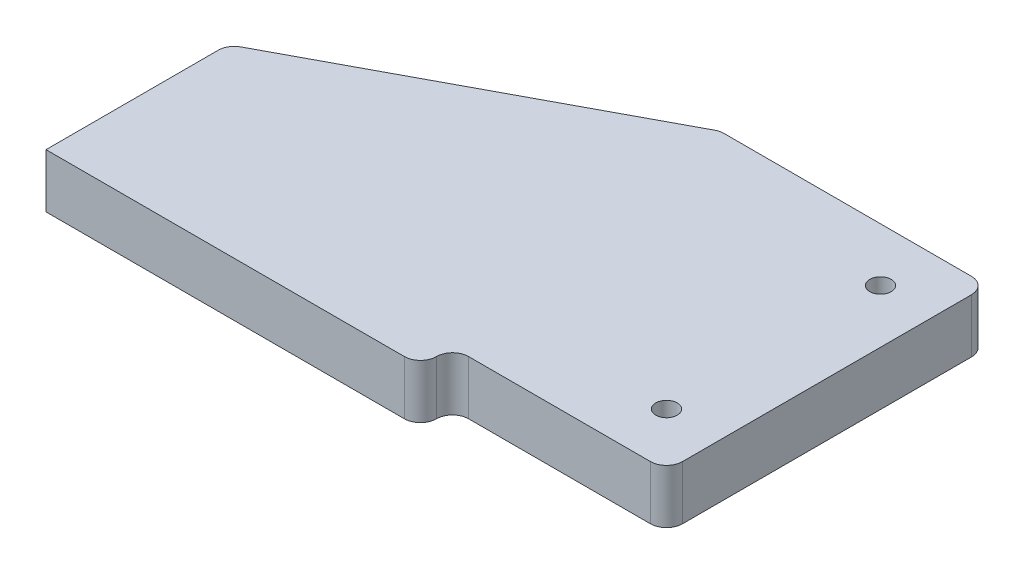
from build123d import *

# Parameters (mm, degrees)
SKETCH1_R           = 1.27
BOSS_EXTRUDE1_DEPTH = 6.4008


with BuildPart() as part:
    # Sketch1 → Boss-Extrude1 (new body)
    with BuildSketch(Plane(origin=(0, 0, 0), x_dir=(1, 0, 0), z_dir=(0, 1, 0))):
        with BuildLine():
            Line((1.905, 0), (23.495, 0))
            ThreePointArc((23.495, 0), (24.842038418, 0.557961582), (25.4, 1.905))
            Line((25.4, 1.905), (25.4, 36.195))
            ThreePointArc((25.4, 36.195), (24.842038418, 37.542038418), (23.495, 38.1))
            Line((23.495, 38.1), (-5.87375, 38.1))
            ThreePointArc((-5.87375, 38.1), (-6.335780366, 38.043121463), (-6.770220588, 37.875882353))
            Line((-6.770220588, 37.875882353), (-43.441470588, 18.317882353))
            ThreePointArc((-43.441470588, 18.317882353), (-44.178524023, 17.617114414), (-44.45, 16.637))
            Line((-44.45, 16.637), (-44.45, -3.81))
            Line((-44.45, -3.81), (-1.905, -3.81))
            ThreePointArc((-1.905, -3.81), (-0.557961582, -3.252038418), (0, -1.905))
            ThreePointArc((0, -1.905), (0.557961582, -0.557961582), (1.905, 0))
        make_face()
        with Locations(Location((19.05, 31.75, 0), (0, 0, 270))):
            Circle(SKETCH1_R, mode=Mode.SUBTRACT)
        with Locations(Location((19.05, 6.35, 0), (0, 0, 270))):
            Circle(SKETCH1_R, mode=Mode.SUBTRACT)
    extrude(amount=BOSS_EXTRUDE1_DEPTH)


solid = part.part
